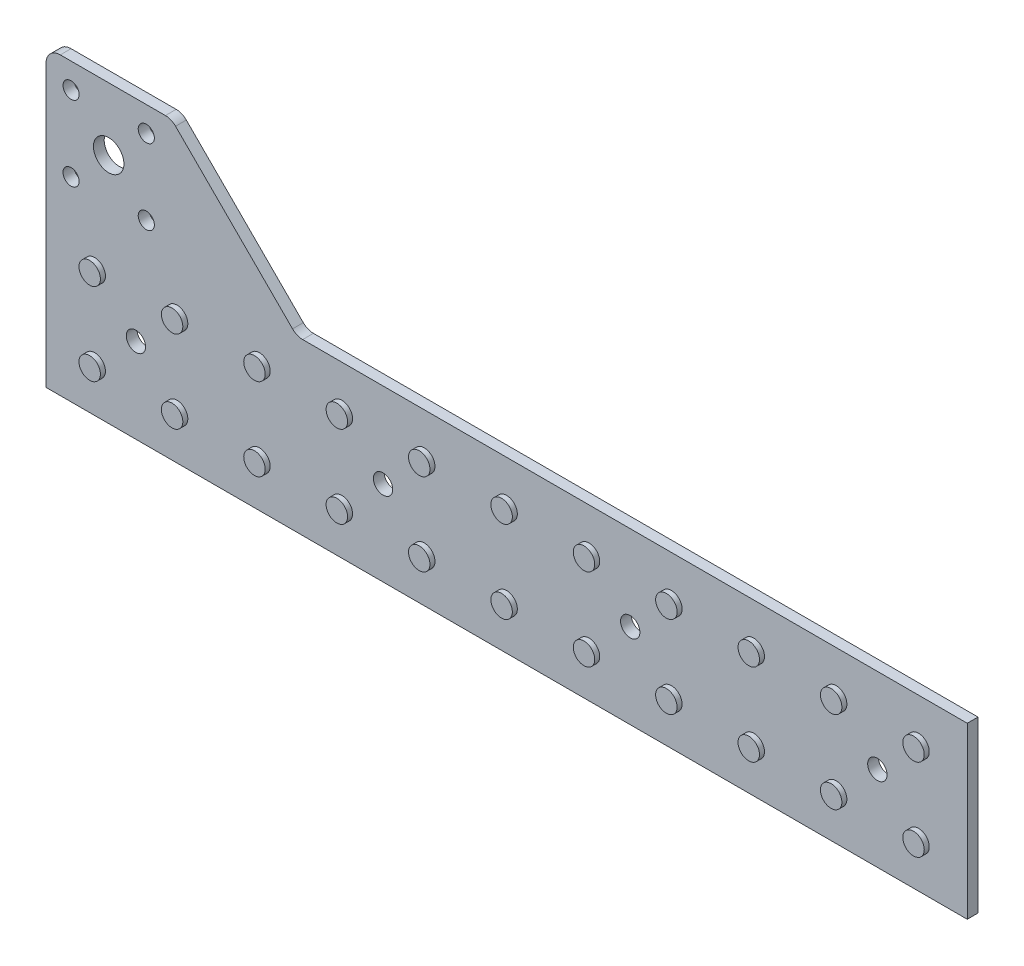
from build123d import *

# Parameters (mm, degrees)
SKETCH1_R            = 2.7
BOSS_EXTRUDE1_DEPTH  = 3
SKETCH3_R            = 2.995
BOSS_EXTRUDE2_DEPTH  = 1.4
LPATTERN1_COUNT      = 2
LPATTERN1_PITCH      = 23
LPATTERN1_COUNT_DIR2 = 11
LPATTERN1_PITCH_DIR2 = 23
FILLET2_R            = 4
SKETCH5_R            = 4.25
SKETCH5_R_2          = 2.25
CUT_EXTRUDE2_DEPTH   = 271.093687449


with BuildPart() as part:
    # Sketch1 → Boss-Extrude1 (new body)
    with BuildSketch(Plane.XY):
        Polygon((0, 0), (257.2, 0), (257.2, 47.4), (70, 47.4), (35, 82.4), (0, 82.4), (0, 47.4), align=None)
        with Locations((232.1, 23.7)):
            Circle(SKETCH1_R, mode=Mode.SUBTRACT)
        with Locations((163.1, 23.7)):
            Circle(SKETCH1_R, mode=Mode.SUBTRACT)
        with Locations((94.1, 23.7)):
            Circle(SKETCH1_R, mode=Mode.SUBTRACT)
        with Locations((25.1, 23.7)):
            Circle(SKETCH1_R, mode=Mode.SUBTRACT)
    extrude(amount=BOSS_EXTRUDE1_DEPTH)

    # Sketch3 → Boss-Extrude2 (add)
    with BuildSketch(Plane.XY.offset(3)):
        with Locations(Location((13.6, 12.2, 0), (0, 0, 180))):
            Circle(SKETCH3_R)
    boss_extrude2 = extrude(amount=BOSS_EXTRUDE2_DEPTH)

    # LPattern1: Boss-Extrude2 2 × 11
    with Locations(*[(j * LPATTERN1_PITCH_DIR2, i * LPATTERN1_PITCH, 0) for i in range(LPATTERN1_COUNT) for j in range(LPATTERN1_COUNT_DIR2) if (i, j) != (0, 0)]):
        add(boss_extrude2)

    # Fillet2
    fillet2_edges = [part.edges().sort_by_distance(p)[0] for p in [
        (0, 82.4, 1.5),
        (35, 82.4, 1.5),
        (70, 47.4, 1.5),
    ]]
    fillet(fillet2_edges, radius=FILLET2_R)

    # Sketch5 → Cut-Extrude2 (cut, through all)
    with BuildSketch(Plane.XY.offset(3)):
        with Locations((17.5, 64.9)):
            Circle(SKETCH5_R)
        with Locations((7, 75.4)):
            Circle(SKETCH5_R_2)
        with Locations((28, 75.4)):
            Circle(SKETCH5_R_2)
        with Locations((28, 54.4)):
            Circle(SKETCH5_R_2)
        with Locations((7, 54.4)):
            Circle(SKETCH5_R_2)
    extrude(amount=-CUT_EXTRUDE2_DEPTH, mode=Mode.SUBTRACT)


solid = part.part
